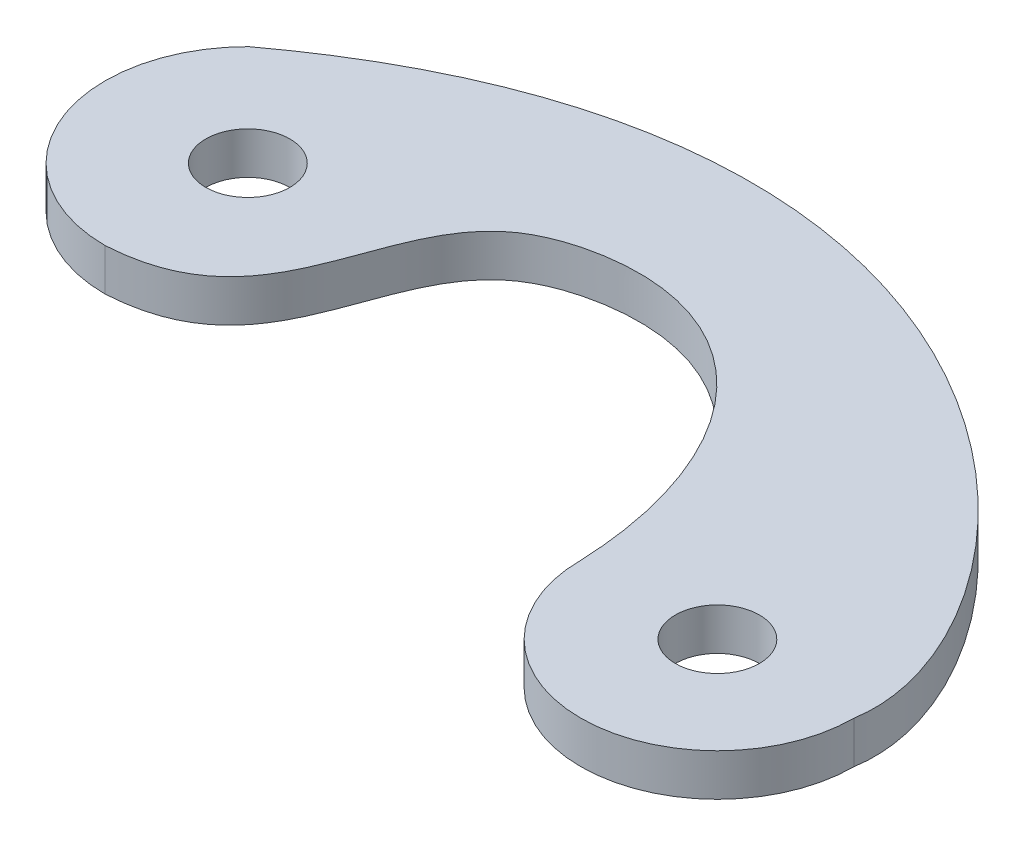
from build123d import *

# Parameters (mm, degrees)
SKETCH1_R           = 2
BOSS_EXTRUDE1_DEPTH = 2


with BuildPart() as part:
    # Sketch1 → Boss-Extrude1 (new body)
    with BuildSketch(Plane(origin=(0, 0, 0), x_dir=(1, 0, 0), z_dir=(0, 1, 0))):
        with BuildLine():
            ThreePointArc((60.25917084, -20.813153262), (66.75917084, -27.313153262), (73.25917084, -20.813153262))
            add(Edge.make_bspline(
                [(73.25917084, -20.813153262), (74.725858168, -12.215971783), (54.126029771, 9.525852706), (31.201928349, -7.551955027)],
                knots=[0, 0, 0, 0, 1, 1, 1, 1], degree=3))
            ThreePointArc((31.201928349, -7.551955027), (29.706944434, -14.955610566), (35.983050773, -19.157941046))
            add(Edge.make_bspline(
                [(35.983050773, -19.157941046), (43.250832756, -18.735453142), (40.848767318, -9.67489742), (54.400187509, -5.83653854), (59.938197313, -12.850383441), (60.25917084, -20.813153262)],
                knots=[0, 0, 0, 0, 0.397902878, 0.497902878, 1, 1, 1, 1], degree=3))
        make_face()
        with Locations(Location((35.983050773, -12.37014883, 0), (0, 0, 270))):
            Circle(SKETCH1_R, mode=Mode.SUBTRACT)
        with Locations(Location((66.75917084, -20.813153262, 0), (0, 0, 270))):
            Circle(SKETCH1_R, mode=Mode.SUBTRACT)
    extrude(amount=BOSS_EXTRUDE1_DEPTH)


solid = part.part
